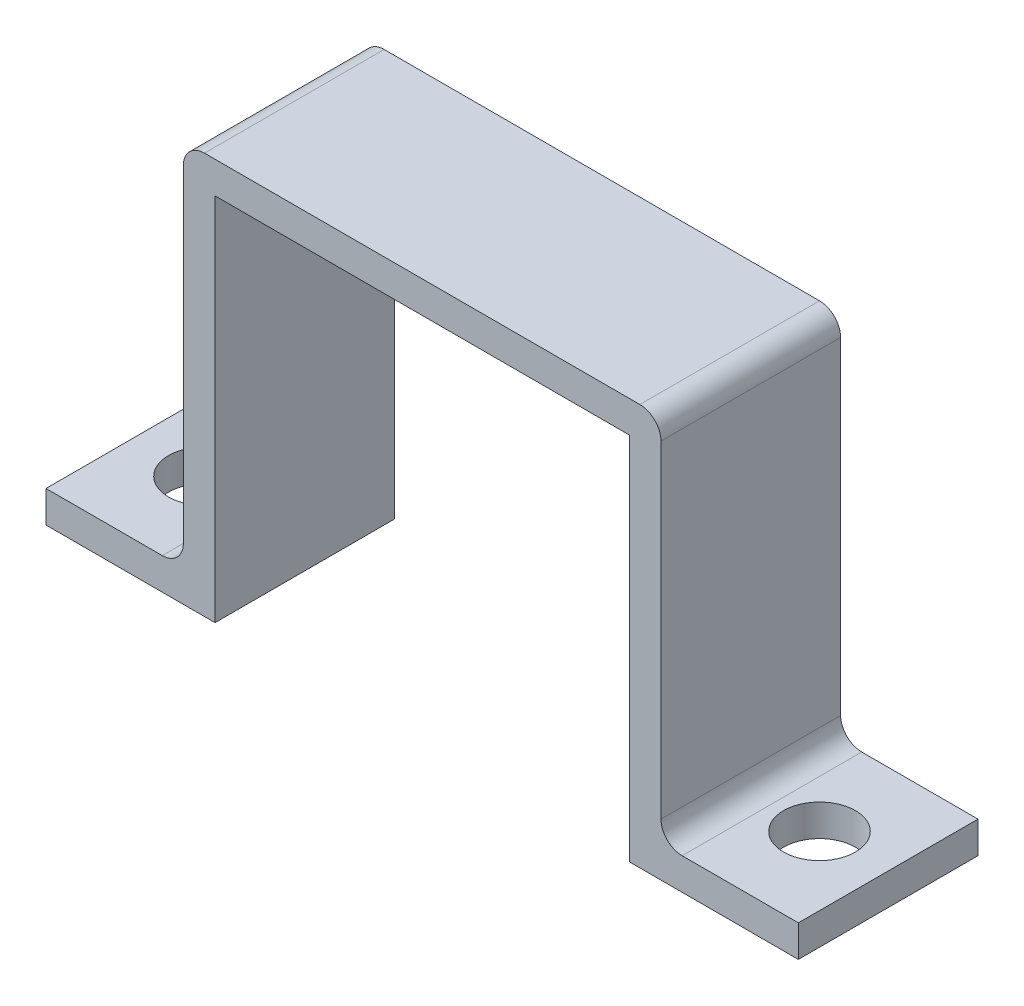
from build123d import *

# Parameters (mm, degrees)
BOSS_EXTRUDE1_DEPTH = 8.5
SKETCH2_R           = 1.7
CUT_EXTRUDE1_DEPTH  = 27.362664888
FILLET1_R           = 1


with BuildPart() as part:
    # Sketch1 → Boss-Extrude1 (new body)
    with BuildSketch(Plane.XY):
        Polygon((-17.8, 0), (-17.8, 1.5), (-11.3, 1.5), (-11.3, 18.99), (11.3, 18.99), (11.3, 1.5), (17.8, 1.5), (17.8, 0), (9.8, 0), (9.8, 17.49), (-9.8, 17.49), (-9.8, 0), align=None)
    extrude(amount=BOSS_EXTRUDE1_DEPTH)

    # Sketch2 → Cut-Extrude1 (cut, through all)
    with BuildSketch(Plane(origin=(0, 1.5, 0), x_dir=(1, 0, 0), z_dir=(0, 1, 0))):
        with Locations(Location((14.55, -4.25, 0), (0, 0, 180))):
            Circle(SKETCH2_R)
    cut_extrude1 = extrude(amount=-CUT_EXTRUDE1_DEPTH, mode=Mode.SUBTRACT)

    # Fillet1
    fillet1_edges = [part.edges().sort_by_distance(p)[0] for p in [
        (-11.3, 1.5, 4.25),
        (-11.3, 18.99, 4.25),
        (11.3, 18.99, 4.25),
        (11.3, 1.5, 4.25),
    ]]
    fillet(fillet1_edges, radius=FILLET1_R)

    # Mirror1: Cut-Extrude1 across plane
    add(cut_extrude1.mirror(Plane(origin=(0, 0, 0), x_dir=(0, 0, 1), z_dir=(1, 0, 0))), mode=Mode.SUBTRACT)


solid = part.part
